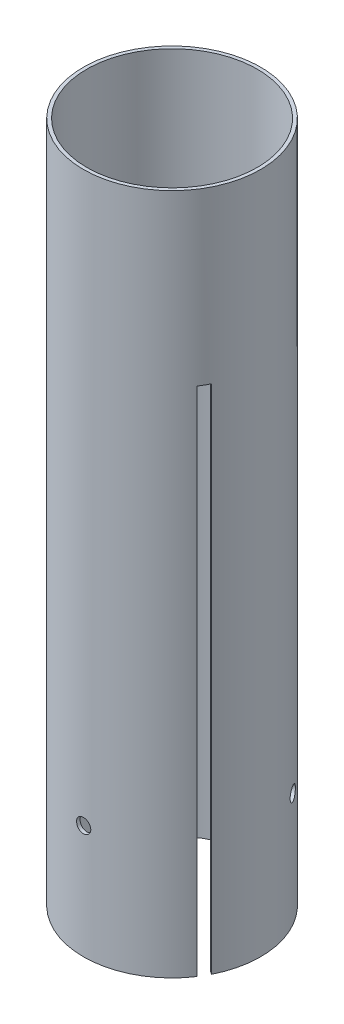
from build123d import *

# Parameters (mm, degrees)
SKETCH2_R           = 39.624
SKETCH2_R_2         = 38.1
BOSS_EXTRUDE1_DEPTH = 304.8
SKETCH3_W           = 4.7625
SKETCH3_H           = 228.6
CUT_EXTRUDE1_DEPTH  = 310.908313461
CIRPATTERN1_COUNT   = 3
SKETCH4_R           = 3.175
CUT_EXTRUDE3_DEPTH  = 310.908313461
CIRPATTERN2_COUNT   = 3


with BuildPart() as part:
    # Sketch2 → Boss-Extrude1 (new body)
    with BuildSketch(Plane(origin=(0, 0, 0), x_dir=(1, 0, 0), z_dir=(0, 1, 0))):
        with Locations(Location((0, 0, 0), (0, 0, 90))):
            Circle(SKETCH2_R)
        with Locations(Location((0, 0, 0), (0, 0, 90))):
            Circle(SKETCH2_R_2, mode=Mode.SUBTRACT)
    extrude(amount=BOSS_EXTRUDE1_DEPTH)

    # Sketch3 → Cut-Extrude1 (cut, through all)
    with BuildSketch(Plane.XY):
        with Locations((0, 114.3)):
            Rectangle(SKETCH3_W, SKETCH3_H)
    cut_extrude1 = extrude(amount=-CUT_EXTRUDE1_DEPTH, mode=Mode.SUBTRACT)

    # CirPattern1: Cut-Extrude1 ×3 about axis
    cirpattern1_axis = Axis((0, 0, 0), (0, 1, 0))
    for i in range(1, CIRPATTERN1_COUNT):
        add(cut_extrude1.rotate(cirpattern1_axis, i * 360 / CIRPATTERN1_COUNT), mode=Mode.SUBTRACT)

    # Sketch4 → Cut-Extrude3 (cut, through all)
    with BuildSketch(Plane.XY):
        with Locations(Location((0, 50.8, 0), (0, 0, 180))):
            Circle(SKETCH4_R)
    cut_extrude3 = extrude(amount=CUT_EXTRUDE3_DEPTH, mode=Mode.SUBTRACT)

    # CirPattern2: Cut-Extrude3 ×3 about axis
    cirpattern2_axis = Axis((0, 304.8, 0), (0, -1, 0))
    for i in range(1, CIRPATTERN2_COUNT):
        add(cut_extrude3.rotate(cirpattern2_axis, i * 360 / CIRPATTERN2_COUNT), mode=Mode.SUBTRACT)


solid = part.part
